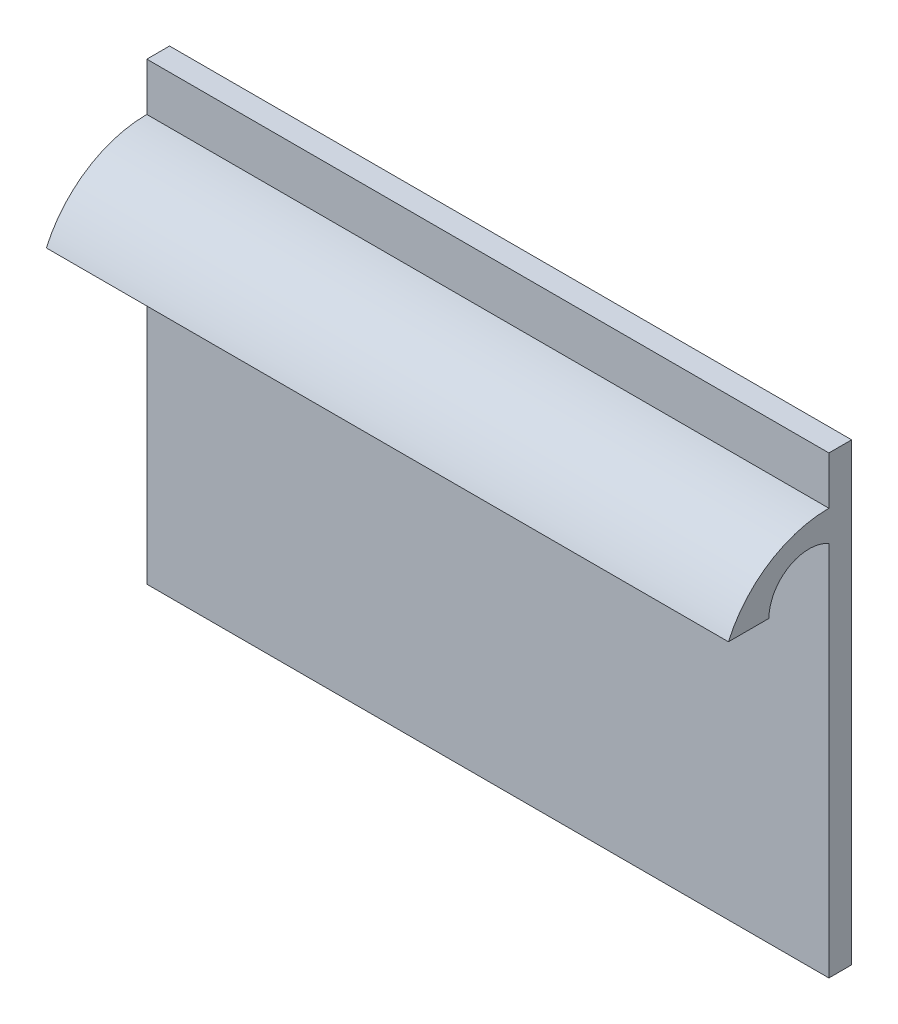
from build123d import *

# Parameters (mm, degrees)
SKETCH1_W           = 300
SKETCH1_H           = 200
BOSS_EXTRUDE1_DEPTH = 10
BOSS_EXTRUDE2_DEPTH = 300


with BuildPart() as part:
    # Sketch1 → Boss-Extrude1 (new body)
    with BuildSketch(Plane.XY):
        Rectangle(SKETCH1_W, SKETCH1_H)
    extrude(amount=BOSS_EXTRUDE1_DEPTH)

    # Sketch4 → Boss-Extrude2 (add)
    with BuildSketch(Plane(origin=(150, 0, 0), x_dir=(0, 0, -1), z_dir=(1, 0, 0))):
        with BuildLine():
            Line((-10, 78.933179658), (-10, 65.521524353))
            ThreePointArc((-10, 65.521524353), (-27.595666073, 65.410986777), (-36.361743784, 50.15400265))
            Line((-36.361743784, 50.15400265), (-54.176069451, 50.15400265))
            ThreePointArc((-54.176069451, 50.15400265), (-36.361743784, 71.103739422), (-10, 78.933179658))
        make_face()
    extrude(amount=-BOSS_EXTRUDE2_DEPTH)


solid = part.part
